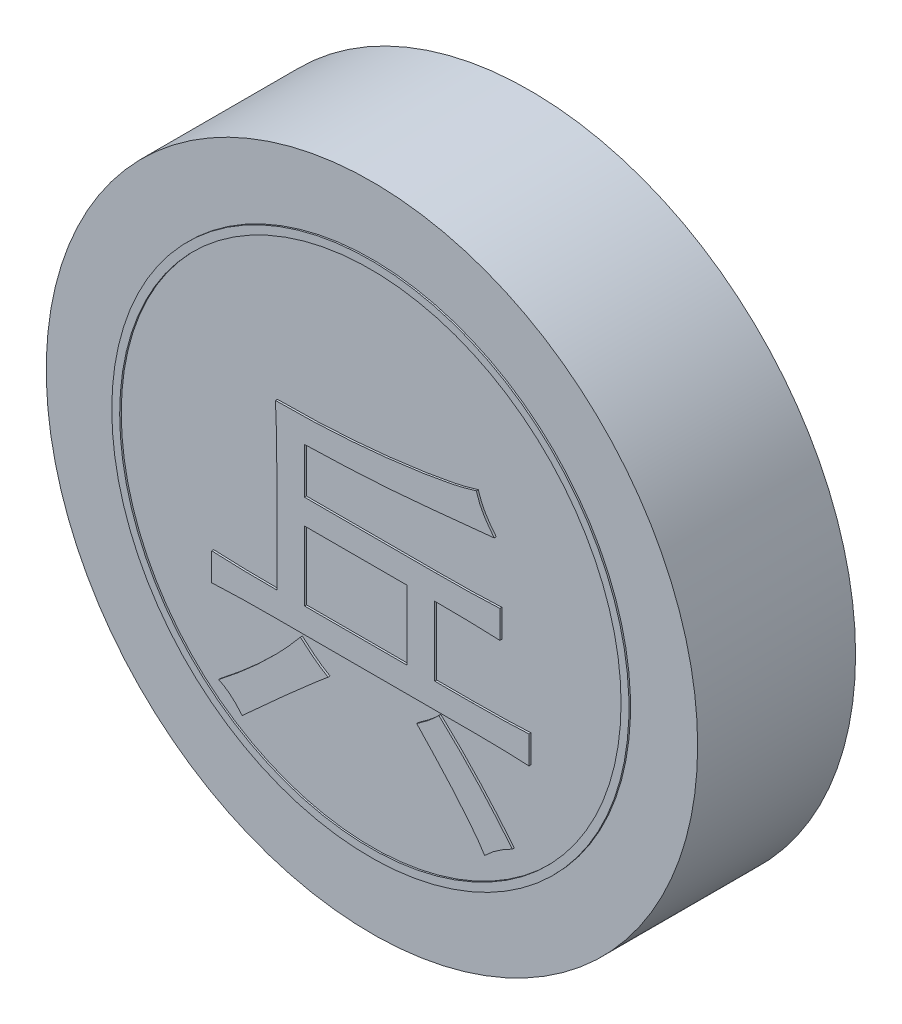
from build123d import *

# Parameters (mm, degrees)
SKETCH_1_R               = 16.5
DIAMETER33_HEIGHT8_DEPTH = 8
SKETCH_2_W               = 5.192982456
SKETCH_2_H               = 3.508771929
CHARACTER_DEPTH          = 0.1
SKETCH_3_R               = 13.1
SKETCH_3_R_2             = 12.7
INK_RING_DEPTH           = 0.08


with BuildPart() as part:
    # 草图1 → Diameter33_Height8 (new body)
    with BuildSketch(Plane.XY):
        Circle(SKETCH_1_R)
    extrude(amount=-DIAMETER33_HEIGHT8_DEPTH)

    # 草图2 → Character_兵 (add)
    # profile 1 of 3: a face of its own
    with BuildSketch(Plane.XY):
        with BuildLine():
            add(Edge.make_bspline(
                [(5.385964912, 5.675438596), (5.427646333, 5.544154901), (5.514415642, 5.270858182), (5.718534697, 4.870645294), (5.979105034, 4.460896452), (6.189038604, 4.198106369), (6.298245614, 4.061403509)],
                knots=[0, 0, 0, 0, 0.883893952, 1.840025262, 2.876385589, 4, 4, 4, 4], degree=3))
            add(Edge.make_bspline(
                [(6.298245614, 4.061403509), (5.963833471, 4.026716097), (5.279490907, 3.955731615), (4.231500891, 3.847667949), (3.138573287, 3.746554234), (2.199926718, 3.654410468), (1.420771678, 3.589929187), (0.809223667, 3.542341458), (0.175852477, 3.501012073), (-0.480095669, 3.465441213), (-1.157529916, 3.430930645), (-1.857588828, 3.402476855), (-2.579333786, 3.379715375), (-3.06800455, 3.366400533), (-3.315789474, 3.359649123)],
                knots=[0, 0, 0, 0, 1.255148332, 2.568541377, 3.933119286, 5.35274168, 6.089508688, 6.851809632, 7.642688325, 8.45900384, 9.304218247, 10.174988169, 11.074611272, 12, 12, 12, 12], degree=3))
            Line((-3.315789474, 3.359649123), (-3.315789474, 1.043859649))
            Line((-3.315789474, 1.043859649), (3.350877193, 1.043859649))
            add(Edge.make_bspline(
                [(3.350877193, 1.043859649), (3.511157354, 1.043351179), (3.823930109, 1.042358944), (4.282215924, 1.049417071), (4.718886002, 1.053533845), (5.133897674, 1.061104446), (5.526304771, 1.072707016), (5.896383806, 1.080969698), (6.244544047, 1.09823882), (6.469784841, 1.108878558), (6.578947368, 1.114035088)],
                knots=[0, 0, 0, 0, 1.191206585, 2.324535747, 3.406356757, 4.43677056, 5.409393768, 6.324087995, 7.187772401, 8, 8, 8, 8], degree=3))
            Line((6.578947368, 1.114035088), (6.578947368, -0.289473684))
            add(Edge.make_bspline(
                [(6.578947368, -0.289473684), (6.325999471, -0.278216628), (5.805513386, -0.255053199), (5.003105502, -0.23621154), (4.156642469, -0.222539126), (3.577870773, -0.220397737), (3.280701754, -0.219298246)],
                knots=[0, 0, 0, 0, 0.920900528, 1.894919528, 2.91915119, 4, 4, 4, 4], degree=3))
            Line((3.280701754, -0.219298246), (3.280701754, -3.728070175))
            Line((3.280701754, -3.728070175), (5.175438596, -3.728070175))
            add(Edge.make_bspline(
                [(5.175438596, -3.728070175), (5.437087744, -3.726975877), (5.945690026, -3.724848744), (6.687326433, -3.711192023), (7.384937776, -3.692513148), (7.835209995, -3.669167553), (8.052631579, -3.657894737)],
                knots=[0, 0, 0, 0, 1.090812078, 2.120356657, 3.092382303, 4, 4, 4, 4], degree=3))
            Line((8.052631579, -3.657894737), (8.052631579, -5.061403509))
            add(Edge.make_bspline(
                [(8.052631579, -5.061403509), (7.837808318, -5.050169454), (7.399653446, -5.027256405), (6.728050321, -5.008178757), (6.030595105, -4.994576557), (5.556645778, -4.992356355), (5.315789474, -4.99122807)],
                knots=[0, 0, 0, 0, 0.942753637, 1.922846234, 2.944411245, 4, 4, 4, 4], degree=3))
            Line((5.315789474, -4.99122807), (-4.929824561, -4.99122807))
            add(Edge.make_bspline(
                [(-4.929824561, -4.99122807), (-5.221796086, -4.992303015), (-5.783243216, -4.994370081), (-6.589858446, -5.007824944), (-7.327331729, -5.026367125), (-7.794924107, -5.050102938), (-8.01754386, -5.061403509)],
                knots=[0, 0, 0, 0, 1.134280796, 2.181167151, 3.134057485, 4, 4, 4, 4], degree=3))
            Line((-8.01754386, -5.061403509), (-8.01754386, -3.657894737))
            add(Edge.make_bspline(
                [(-8.01754386, -3.657894737), (-7.918780668, -3.663109409), (-7.710021339, -3.67413185), (-7.380044631, -3.691202686), (-7.016884144, -3.699292609), (-6.621013356, -3.710966152), (-6.192136611, -3.718460184), (-5.730343207, -3.722568458), (-5.235668056, -3.729595696), (-4.895172776, -3.728589765), (-4.719298246, -3.728070175)],
                knots=[0, 0, 0, 0, 0.719411058, 1.520645164, 2.403271333, 3.3614919, 4.401477414, 5.52328659, 6.720714106, 8, 8, 8, 8], degree=3))
            Line((-4.719298246, -3.728070175), (-4.719298246, 1.535087719))
            add(Edge.make_bspline(
                [(-4.719298246, 1.535087719), (-4.718784553, 1.689303498), (-4.717785992, 1.989081562), (-4.724827935, 2.426573997), (-4.728954195, 2.839853385), (-4.736476359, 3.228877821), (-4.748135548, 3.593555392), (-4.756324903, 3.934194089), (-4.77353537, 4.251158894), (-4.784297949, 4.45473273), (-4.789473684, 4.552631579)],
                knots=[0, 0, 0, 0, 1.226022714, 2.383249742, 3.478491498, 4.511863319, 5.476544353, 6.379262498, 7.220585815, 8, 8, 8, 8], degree=3))
            add(Edge.make_bspline(
                [(-4.789473684, 4.552631579), (-4.268706026, 4.556028892), (-3.23884814, 4.562747339), (-1.711781979, 4.634250298), (-0.219866652, 4.740633472), (0.993183313, 4.869797657), (1.923704926, 4.988295648), (2.567560235, 5.078693798), (3.161212168, 5.171746835), (3.703352911, 5.268528417), (4.196476895, 5.362226591), (4.637690365, 5.465343924), (5.030740941, 5.563211427), (5.272785841, 5.639681531), (5.385964912, 5.675438596)],
                knots=[0, 0, 0, 0, 1.826039719, 3.611133242, 5.359645429, 7.070379028, 7.888093123, 8.64899991, 9.350260421, 9.995089588, 10.580183652, 11.110071571, 11.583873602, 12, 12, 12, 12], degree=3))
        make_face()
        with Locations((-0.719298246, -1.973684211)):
            Rectangle(SKETCH_2_W, SKETCH_2_H, mode=Mode.SUBTRACT)
    # profile 2 of 3: a face of its own
    with BuildSketch(Plane.XY):
        with BuildLine():
            add(Edge.make_bspline(
                [(-2.122807018, -6.254385965), (-2.157477947, -6.282955909), (-2.239146675, -6.350253527), (-2.380099943, -6.467370774), (-2.555580621, -6.61772706), (-2.766181537, -6.799581185), (-3.010546273, -7.013645708), (-3.292157091, -7.257784349), (-3.608078345, -7.535369573), (-4.067550245, -7.940488445), (-4.641654961, -8.448307776), (-5.298106508, -9.038691618), (-5.905984263, -9.586353364), (-6.289571124, -9.942900475), (-6.473684211, -10.114035088)],
                knots=[0, 0, 0, 0, 0.2780539, 0.654966813, 1.134206325, 1.708249881, 2.37711475, 3.1448483, 4.014977533, 4.979944052, 6.936134783, 8.758754283, 10.444274784, 12, 12, 12, 12], degree=3))
            add(Edge.make_bspline(
                [(-6.473684211, -10.114035088), (-6.56675088, -10.003646022), (-6.746034395, -9.790992666), (-7.041333181, -9.517105251), (-7.343912266, -9.291855461), (-7.560952619, -9.184075455), (-7.666666667, -9.131578947)],
                knots=[0, 0, 0, 0, 1.110089453, 2.138474913, 3.093305237, 4, 4, 4, 4], degree=3))
            add(Edge.make_bspline(
                [(-7.666666667, -9.131578947), (-7.459526486, -8.969004344), (-7.051586638, -8.648831509), (-6.464306615, -8.155016872), (-5.902342388, -7.666058703), (-5.371814437, -7.172889256), (-4.86718458, -6.682628792), (-4.391277213, -6.192029207), (-3.945527473, -5.699881064), (-3.664825977, -5.366338586), (-3.526315789, -5.201754386)],
                knots=[0, 0, 0, 0, 1.104789882, 2.175762404, 3.219109849, 4.230036466, 5.214606813, 6.170942573, 7.097464421, 8, 8, 8, 8], degree=3))
            add(Edge.make_bspline(
                [(-3.526315789, -5.201754386), (-3.402072492, -5.313438732), (-3.163971761, -5.527471401), (-2.800509792, -5.808406095), (-2.461726053, -6.055622784), (-2.232199656, -6.190231325), (-2.122807018, -6.254385965)],
                knots=[0, 0, 0, 0, 1.1399807, 2.184667066, 3.134809496, 4, 4, 4, 4], degree=3))
        make_face()
    # profile 3 of 3: a face of its own
    with BuildSketch(Plane.XY):
        with BuildLine():
            add(Edge.make_bspline(
                [(3.49122807, -5.131578947), (3.64506879, -5.27574038), (3.958953573, -5.569876289), (4.429694762, -6.029809869), (4.906171195, -6.5186042), (5.550446937, -7.196959293), (6.333416052, -8.059114332), (6.921508711, -8.778189908), (7.210526316, -9.131578947)],
                knots=[0, 0, 0, 0, 0.694198963, 1.416390223, 2.166820141, 2.941675304, 4.4969891, 6, 6, 6, 6], degree=3))
            add(Edge.make_bspline(
                [(7.210526316, -9.131578947), (7.075068051, -9.202301891), (6.810022921, -9.340682313), (6.440864575, -9.578307626), (6.104530191, -9.83226378), (5.905037831, -10.021201035), (5.807017544, -10.114035088)],
                knots=[0, 0, 0, 0, 1.065427554, 2.08467446, 3.058907518, 4, 4, 4, 4], degree=3))
            add(Edge.make_bspline(
                [(5.807017544, -10.114035088), (5.775308721, -10.061834257), (5.708542231, -9.951919541), (5.596075389, -9.783319805), (5.468667601, -9.601351476), (5.325294262, -9.406676418), (5.167099041, -9.197729098), (4.988610452, -8.978683169), (4.801321577, -8.740479229), (4.591580283, -8.495595111), (4.370378942, -8.233593029), (4.132600709, -7.959359408), (3.876016732, -7.67337978), (3.606767352, -7.371008487), (3.318813913, -7.058440113), (3.015682826, -6.732539485), (2.699522295, -6.391233684), (2.480469315, -6.161414802), (2.368421053, -6.043859649)],
                knots=[0, 0, 0, 0, 0.549342762, 1.156702925, 1.82258923, 2.54738719, 3.331395419, 4.179695988, 5.088851071, 6.056731025, 7.079525855, 8.173336188, 9.321433762, 10.535553977, 11.815185591, 13.144150694, 14.539198359, 16, 16, 16, 16], degree=3))
            add(Edge.make_bspline(
                [(2.368421053, -6.043859649), (2.471264109, -5.972803187), (2.674770245, -5.832196455), (2.965216422, -5.609367892), (3.237954519, -5.37712719), (3.407172595, -5.213070577), (3.49122807, -5.131578947)],
                knots=[0, 0, 0, 0, 1.035169059, 2.048395507, 3.030582027, 4, 4, 4, 4], degree=3))
        make_face()
    extrude(amount=CHARACTER_DEPTH)

    # 草图3 → Ink_ring (add)
    with BuildSketch(Plane.XY):
        with Locations(Location((0, 0, 0), (0, 0, 180))):
            Circle(SKETCH_3_R)
        with Locations(Location((0, 0, 0), (0, 0, 180))):
            Circle(SKETCH_3_R_2, mode=Mode.SUBTRACT)
    extrude(amount=INK_RING_DEPTH)


solid = part.part
